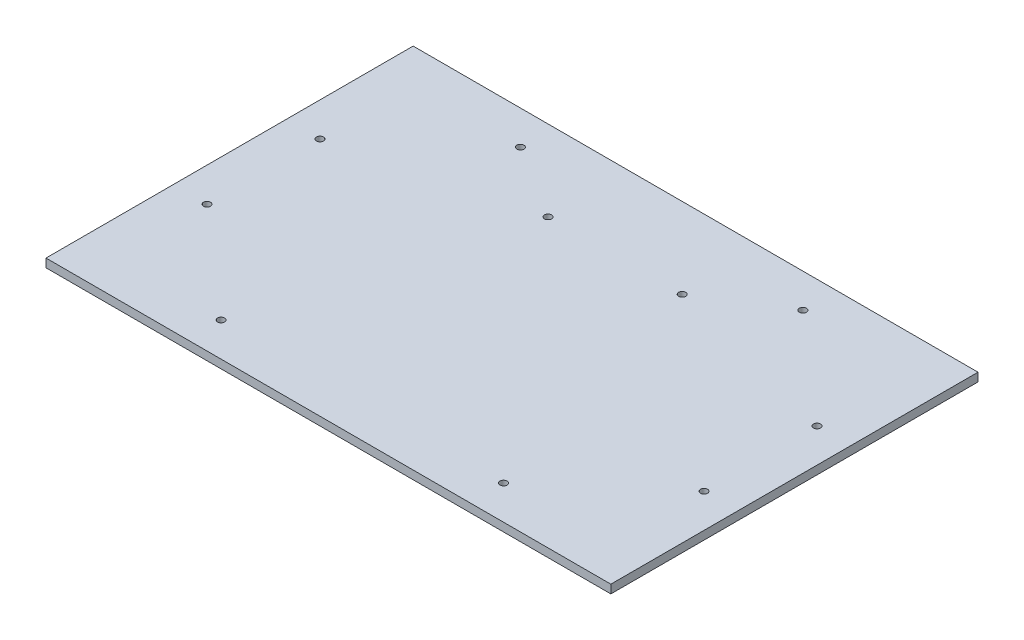
from build123d import *

# Parameters (mm, degrees)
ESQUISSE1_W             = 400
ESQUISSE1_H             = 260
BOSS_EXTRU_1_DEPTH      = 6
ESQUISSE2_R             = 2.5
ENL_V_MAT_EXTRU_1_DEPTH = 239.612656831
ESQUISSE3_R             = 2.5
ENL_V_MAT_EXTRU_2_DEPTH = 239.612656831
CHANFREIN2_SIZE         = 2


with BuildPart() as part:
    # Esquisse1 → Boss.-Extru.1 (new body)
    with BuildSketch(Plane(origin=(0, 0, 0), x_dir=(1, 0, 0), z_dir=(0, 1, 0))):
        Rectangle(ESQUISSE1_W, ESQUISSE1_H)
    extrude(amount=BOSS_EXTRU_1_DEPTH)

    # Esquisse2 → Enlèv. mat.-Extru.1 (cut, through all)
    with BuildSketch(Plane.XZ):
        with Locations(Location((-100, 106, 0), (0, 0, 270))):
            Circle(ESQUISSE2_R)
        with Locations(Location((100, 106, 0), (0, 0, 270))):
            Circle(ESQUISSE2_R)
        with Locations(Location((176, 40, 0), (0, 0, 270))):
            Circle(ESQUISSE2_R)
        with Locations(Location((176, -40, 0), (0, 0, 270))):
            Circle(ESQUISSE2_R)
        with Locations(Location((100, -106, 0), (0, 0, 270))):
            Circle(ESQUISSE2_R)
        with Locations(Location((-100, -106, 0), (0, 0, 270))):
            Circle(ESQUISSE2_R)
        with Locations(Location((-176, -40, 0), (0, 0, 270))):
            Circle(ESQUISSE2_R)
        with Locations(Location((-176, 40, 0), (0, 0, 270))):
            Circle(ESQUISSE2_R)
    extrude(amount=-ENL_V_MAT_EXTRU_1_DEPTH, mode=Mode.SUBTRACT)

    # Esquisse3 → Enlèv. mat.-Extru.2 (cut, through all)
    with BuildSketch(Plane.XZ):
        with Locations(Location((47.5, -73, 0), (0, 0, 270))):
            Circle(ESQUISSE3_R)
        with Locations(Location((-47.5, -73, 0), (0, 0, 270))):
            Circle(ESQUISSE3_R)
    extrude(amount=-ENL_V_MAT_EXTRU_2_DEPTH, mode=Mode.SUBTRACT)

    # Chanfrein2
    chanfrein2_edges = [part.edges().sort_by_distance(p)[0] for p in [
        (47.5, 0, -70.5),
        (-47.5, 0, -70.5),
    ]]
    chamfer(chanfrein2_edges, length=CHANFREIN2_SIZE)


solid = part.part
